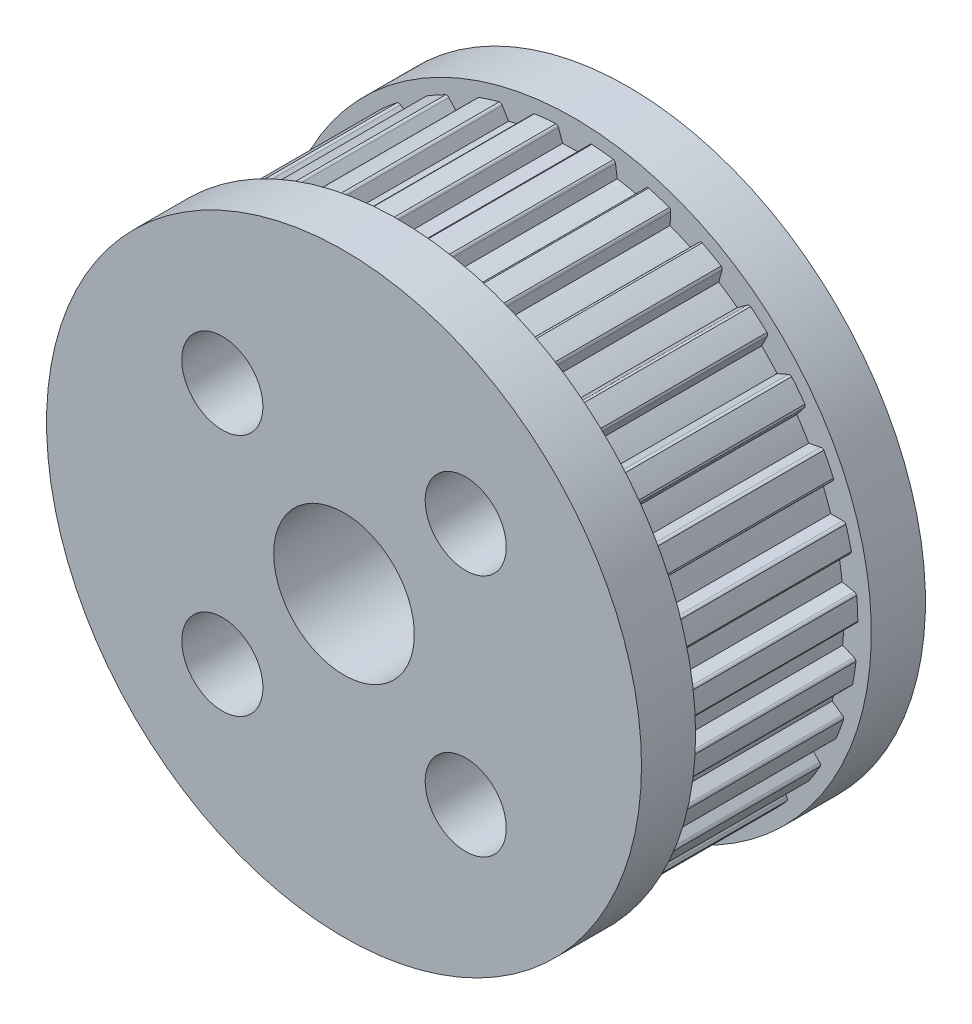
from build123d import *

# Parameters (mm, degrees)
ESQUISSE1_R                  = 10.5
BOSS_EXTRU_1_DEPTH           = 6.5
ENL_V_MAT_EXTRU_1_REACH      = 18.21
R_P_TITION_CIRCULAIRE1_COUNT = 31
R_P_TITION_CIRCULAIRE1_ANGLE = 348.36
ESQUISSE3_R                  = 11
BOSS_EXTRU_2_DEPTH           = 2
BOSS_EXTRU_3_START           = 2
ESQUISSE4_R                  = 11
BOSS_EXTRU_3_DEPTH           = 2
ESQUISSE5_R                  = 2.6
ESQUISSE5_R_2                = 1.5
ENL_V_MAT_EXTRU_2_DEPTH      = 19.768324379
ESQUISSE6_R                  = 9.65
ENL_V_MAT_EXTRU_3_DEPTH      = 5


with BuildPart() as part:
    # Esquisse1 → Boss.-Extru.1 (new body)
    with BuildSketch(Plane.XY):
        with Locations(Location((0, 0, 0), (0, 0, 180))):
            Circle(ESQUISSE1_R)
    extrude(amount=BOSS_EXTRU_1_DEPTH)

    # Esquisse2 → Enlèv. mat.-Extru.1 (cut, up to next)
    with BuildSketch(Plane.XY.offset(6.5), mode=Mode.PRIVATE) as enl_v_mat_extru_1_sk1:
        with BuildLine():
            Line((-0.415, 9.971755042), (-0.570652096, 10.399405661))
            ThreePointArc((-0.570652096, 10.399405661), (-0.617093871, 10.461198095), (-0.691945524, 10.480495074))
            Line((-0.691945524, 10.480495074), (-1.016, 10.464077598))
            Line((-1.016, 10.464077598), (-1.016, 11.112590931))
            Line((-1.016, 11.112590931), (1.014365396, 11.112590931))
            Line((1.014365396, 11.112590931), (1.014365396, 10.464077598))
            Line((1.014365396, 10.464077598), (0.691945524, 10.480495074))
            ThreePointArc((0.691945524, 10.480495074), (0.617093871, 10.461198095), (0.570652096, 10.399405661))
            Line((0.570652096, 10.399405661), (0.415, 9.971755042))
            ThreePointArc((0.415, 9.971755042), (0, 9.980386947), (-0.415, 9.971755042))
        make_face()
    enl_v_mat_extru_1_tool1 = extrude(enl_v_mat_extru_1_sk1.sketch, amount=-ENL_V_MAT_EXTRU_1_REACH, mode=Mode.PRIVATE) & part.part
    enl_v_mat_extru_1 = enl_v_mat_extru_1_tool1.solids().sort_by_distance((-0.00059, 10.638353, 6.5))[0]
    add(enl_v_mat_extru_1, mode=Mode.SUBTRACT)

    # Répétition circulaire1: Enlèv. mat.-Extru.1 ×31 about axis
    r_p_tition_circulaire1_axis = Axis((0, 0, 0), (0, 0, 1))
    for i in range(1, R_P_TITION_CIRCULAIRE1_COUNT):
        add(enl_v_mat_extru_1.rotate(r_p_tition_circulaire1_axis, i * R_P_TITION_CIRCULAIRE1_ANGLE / (R_P_TITION_CIRCULAIRE1_COUNT - 1)), mode=Mode.SUBTRACT)

    # Esquisse3 → Boss.-Extru.2 (add)
    with BuildSketch(Plane.XY.offset(6.5)):
        Circle(ESQUISSE3_R)
    extrude(amount=BOSS_EXTRU_2_DEPTH)

    # Esquisse4 → Boss.-Extru.3 (add)
    with BuildSketch(Plane(origin=(0, 0, 0), x_dir=(-1, 0, 0), z_dir=(0, 0, -1)).offset(BOSS_EXTRU_3_START)):
        with Locations(Location((0, 0, 0), (0, 0, 180))):
            Circle(ESQUISSE4_R)
    extrude(amount=-BOSS_EXTRU_3_DEPTH)

    # Esquisse5 → Enlèv. mat.-Extru.2 (cut, through all)
    with BuildSketch(Plane(origin=(0, 0, -2), x_dir=(-1, 0, 0), z_dir=(0, 0, -1))):
        Circle(ESQUISSE5_R)
        with Locations((-4.5, 4.5)):
            Circle(ESQUISSE5_R_2)
        with Locations((-4.5, -4.5)):
            Circle(ESQUISSE5_R_2)
        with Locations((4.5, -4.5)):
            Circle(ESQUISSE5_R_2)
        with Locations((4.5, 4.5)):
            Circle(ESQUISSE5_R_2)
    extrude(amount=-ENL_V_MAT_EXTRU_2_DEPTH, mode=Mode.SUBTRACT)

    # Esquisse6 → Enlèv. mat.-Extru.3 (cut)
    with BuildSketch(Plane(origin=(0, 0, -2), x_dir=(-1, 0, 0), z_dir=(0, 0, -1))):
        Circle(ESQUISSE6_R)
    extrude(amount=-ENL_V_MAT_EXTRU_3_DEPTH, mode=Mode.SUBTRACT)


solid = part.part
